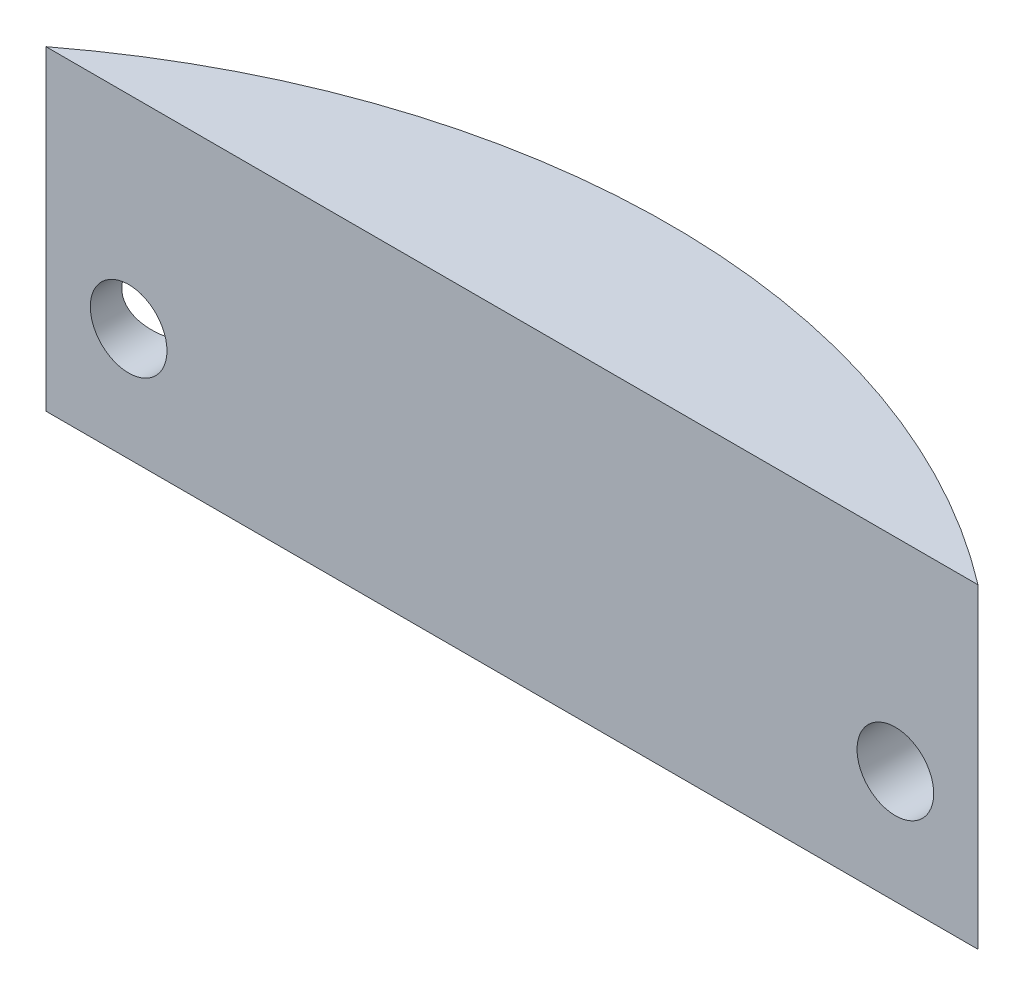
from build123d import *

# Parameters (mm, degrees)
BOSS_EXTRUDE1_DEPTH = 35
SKETCH2_R           = 4.25
CUT_EXTRUDE1_DEPTH  = 10


with BuildPart() as part:
    # Sketch1 → Boss-Extrude1 (new body)
    with BuildSketch(Plane(origin=(0, 0, 0), x_dir=(1, 0, 0), z_dir=(0, 1, 0))):
        with BuildLine():
            Line((-51.659945799, 67.5), (51.659945799, 67.5))
            ThreePointArc((51.659945799, 67.5), (0, 85), (-51.659945799, 67.5))
        make_face()
    extrude(amount=BOSS_EXTRUDE1_DEPTH)

    # Sketch2 → Cut-Extrude1 (cut)
    with BuildSketch(Plane.XY.offset(-67.5)):
        with Locations((-42.5, 12.5)):
            Circle(SKETCH2_R)
        with Locations((42.5, 12.5)):
            Circle(SKETCH2_R)
    extrude(amount=-CUT_EXTRUDE1_DEPTH, mode=Mode.SUBTRACT)


solid = part.part
